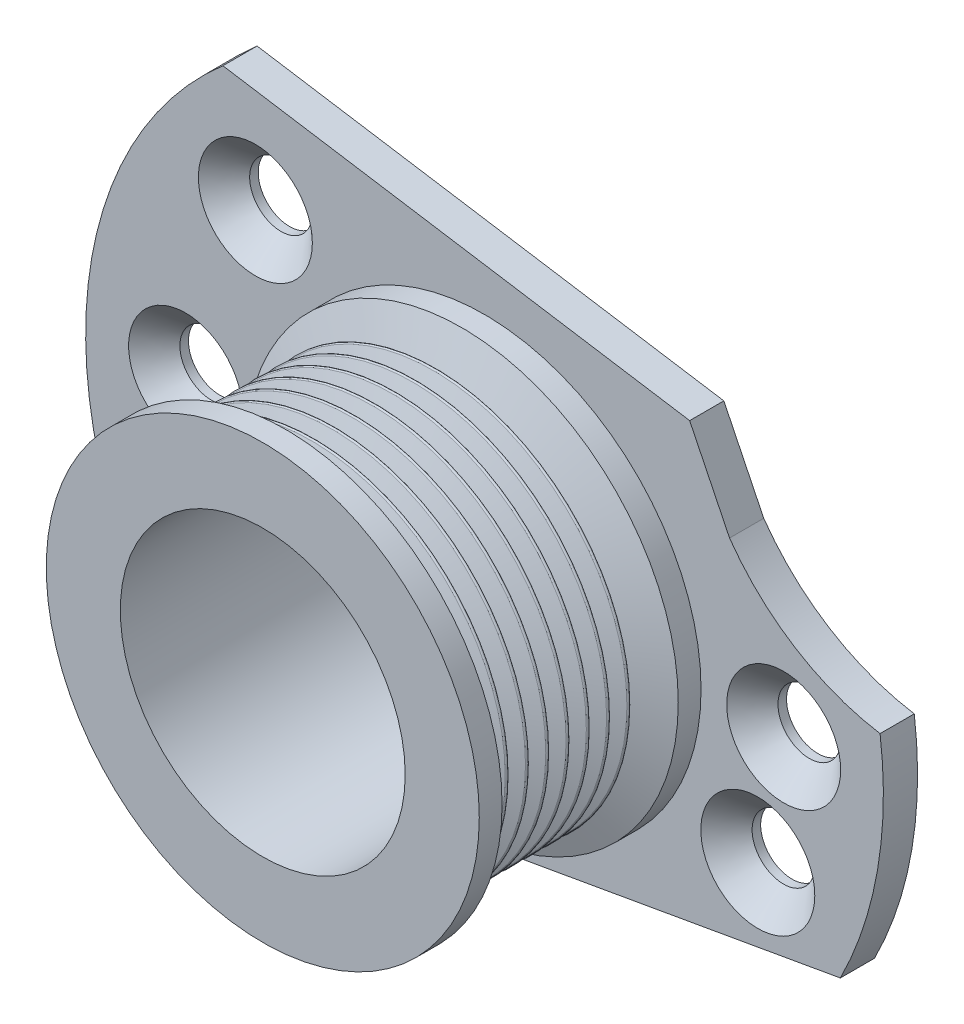
from build123d import *

# Parameters (mm, degrees)
ESBO_O1_R                                    = 25
RESSALTO_EXTRUS_O1_DEPTH                     = 6
ESCAREADO_PARA_PARAFUSO_COM_CABE_A_E_2_COUNT = 2
ESCAREADO_PARA_PARAFUSO_COM_CABE_A_E_2_PITCH = 21.830727536
ESCAREADO_PARA_PARAFUSO_COM_CABE_A_E_3_COUNT = 2
ESCAREADO_PARA_PARAFUSO_COM_CABE_A_E_3_PITCH = 100.140279829
ESCAREADO_PARA_PARAFUSO_COM_CABE_A_E_4_COUNT = 2
ESCAREADO_PARA_PARAFUSO_COM_CABE_A_E_4_PITCH = 98.667725183
ESCAREADO_PARA_PARAFUSO_COM_CABE_A_E_5_COUNT = 2
ESCAREADO_PARA_PARAFUSO_COM_CABE_A_E_5_PITCH = 104.980943736


with BuildPart() as part:
    # Esboço1 → Ressalto-extrusão1 (new body)
    with BuildSketch(Plane.XY):
        with BuildLine():
            ThreePointArc((69.419017567, 9), (68.990697606, -11.844139642), (62.442457631, -31.637627677))
            Line((62.442457631, -31.637627677), (-47.856010707, -51.086223576))
            ThreePointArc((-47.856010707, -51.086223576), (-69.987847396, 1.304307037), (-45.919336355, 52.833839049))
            Line((-45.919336355, 52.833839049), (36, 39.859090809))
            Line((36, 39.859090809), (43, 25.506963918))
            ThreePointArc((43, 25.506963918), (54.5365333, 14.575923027), (69.419017567, 9))
        make_face()
        Circle(ESBO_O1_R, mode=Mode.SUBTRACT)
    extrude(amount=RESSALTO_EXTRUS_O1_DEPTH)

    # Esboço4 → Escareado para parafuso com cabeça escareada chata de M101 (revolve, cut)
    with BuildSketch(Plane(origin=(52.5, 0, 6), x_dir=(0, -1, 0), z_dir=(1, 0, 0))):
        Polygon((0, 0), (0, 6), (5.5, 6), (5.5, 4.5), (10, 0), align=None)
    escareado_para_parafuso_com_cabe_a_escar = revolve(axis=Axis((52.5, 0, 12.35), (0, 0, -1)), mode=Mode.SUBTRACT)

    # Escareado para parafuso com cabe_a e 2: Escareado para parafuso com cabeça escareada chata de M101 ×2
    with Locations(*[Vector(-0.2079116908177597, -0.9781476007338056, 0) * (i * ESCAREADO_PARA_PARAFUSO_COM_CABE_A_E_2_PITCH) for i in range(1, ESCAREADO_PARA_PARAFUSO_COM_CABE_A_E_2_COUNT)]):
        add(escareado_para_parafuso_com_cabe_a_escar, mode=Mode.SUBTRACT)

    # Escareado para parafuso com cabe_a e 3: Escareado para parafuso com cabeça escareada chata de M101 ×2
    with Locations(*[Vector(-0.9537169507482278, -0.3007057995042705, 0) * (i * ESCAREADO_PARA_PARAFUSO_COM_CABE_A_E_3_PITCH) for i in range(1, ESCAREADO_PARA_PARAFUSO_COM_CABE_A_E_3_COUNT)]):
        add(escareado_para_parafuso_com_cabe_a_escar, mode=Mode.SUBTRACT)

    # Escareado para parafuso com cabe_a e 4: Escareado para parafuso com cabeça escareada chata de M101 ×2
    with Locations(*[Vector(-0.9396926207859094, 0.3420201433256661, 0) * (i * ESCAREADO_PARA_PARAFUSO_COM_CABE_A_E_4_PITCH) for i in range(1, ESCAREADO_PARA_PARAFUSO_COM_CABE_A_E_4_COUNT)]):
        add(escareado_para_parafuso_com_cabe_a_escar, mode=Mode.SUBTRACT)

    # Escareado para parafuso com cabe_a e 5: Escareado para parafuso com cabeça escareada chata de M101 ×2
    with Locations(*[Vector(-0.9998185117713208, 0.019051076593764486, 0) * (i * ESCAREADO_PARA_PARAFUSO_COM_CABE_A_E_5_PITCH) for i in range(1, ESCAREADO_PARA_PARAFUSO_COM_CABE_A_E_5_COUNT)]):
        add(escareado_para_parafuso_com_cabe_a_escar, mode=Mode.SUBTRACT)

    # Esboço5 → Revolução1 (revolve)
    with BuildSketch(Plane(origin=(0, 0, 0), x_dir=(0, 0, -1), z_dir=(1, 0, 0)), mode=Mode.PRIVATE) as revolu_o1_sk:
        with BuildLine():
            Line((-6, 25), (-44.92, 25))
            Line((-44.92, 25), (-44.92, 38))
            Line((-44.92, 38), (-40.92, 38))
            Line((-40.92, 38), (-38.38984631, 31.04845987))
            ThreePointArc((-38.38984631, 31.04845987), (-37.92, 30.719469942), (-37.45015369, 31.04845987))
            Line((-37.45015369, 31.04845987), (-36.374923155, 34.002631484))
            ThreePointArc((-36.374923155, 34.002631484), (-36.14, 34.167126448), (-35.905076845, 34.002631484))
            Line((-35.905076845, 34.002631484), (-34.82984631, 31.04845987))
            ThreePointArc((-34.82984631, 31.04845987), (-34.36, 30.719469942), (-33.89015369, 31.04845987))
            Line((-33.89015369, 31.04845987), (-32.814923155, 34.002631484))
            ThreePointArc((-32.814923155, 34.002631484), (-32.58, 34.167126448), (-32.345076845, 34.002631484))
            Line((-32.345076845, 34.002631484), (-31.26984631, 31.04845987))
            ThreePointArc((-31.26984631, 31.04845987), (-30.8, 30.719469942), (-30.33015369, 31.04845987))
            Line((-30.33015369, 31.04845987), (-29.254923155, 34.002631484))
            ThreePointArc((-29.254923155, 34.002631484), (-29.02, 34.167126448), (-28.785076845, 34.002631484))
            Line((-28.785076845, 34.002631484), (-27.70984631, 31.04845987))
            ThreePointArc((-27.70984631, 31.04845987), (-27.24, 30.719469942), (-26.77015369, 31.04845987))
            Line((-26.77015369, 31.04845987), (-25.694923155, 34.002631484))
            ThreePointArc((-25.694923155, 34.002631484), (-25.46, 34.167126448), (-25.225076845, 34.002631484))
            Line((-25.225076845, 34.002631484), (-24.14984631, 31.04845987))
            ThreePointArc((-24.14984631, 31.04845987), (-23.68, 30.719469942), (-23.21015369, 31.04845987))
            Line((-23.21015369, 31.04845987), (-22.134923155, 34.002631484))
            ThreePointArc((-22.134923155, 34.002631484), (-21.9, 34.167126448), (-21.665076845, 34.002631484))
            Line((-21.665076845, 34.002631484), (-20.58984631, 31.04845987))
            ThreePointArc((-20.58984631, 31.04845987), (-20.12, 30.719469942), (-19.65015369, 31.04845987))
            Line((-19.65015369, 31.04845987), (-18.574923155, 34.002631484))
            ThreePointArc((-18.574923155, 34.002631484), (-18.34, 34.167126448), (-18.105076845, 34.002631484))
            Line((-18.105076845, 34.002631484), (-17.02984631, 31.04845987))
            ThreePointArc((-17.02984631, 31.04845987), (-16.56, 30.719469942), (-16.09015369, 31.04845987))
            Line((-16.09015369, 31.04845987), (-15.014923155, 34.002631484))
            ThreePointArc((-15.014923155, 34.002631484), (-14.78, 34.167126448), (-14.545076845, 34.002631484))
            Line((-14.545076845, 34.002631484), (-13.46984631, 31.04845987))
            ThreePointArc((-13.46984631, 31.04845987), (-13, 30.719469942), (-12.53015369, 31.04845987))
            Line((-12.53015369, 31.04845987), (-10, 38))
            Line((-10, 38), (-6, 38))
            Line((-6, 38), (-6, 25))
        make_face()
    revolve(revolu_o1_sk.sketch.rotate(Axis((0, 0, 6), (0, 0, -1)), 90), axis=Axis((0, 0, 6), (0, 0, -1)))


solid = part.part
